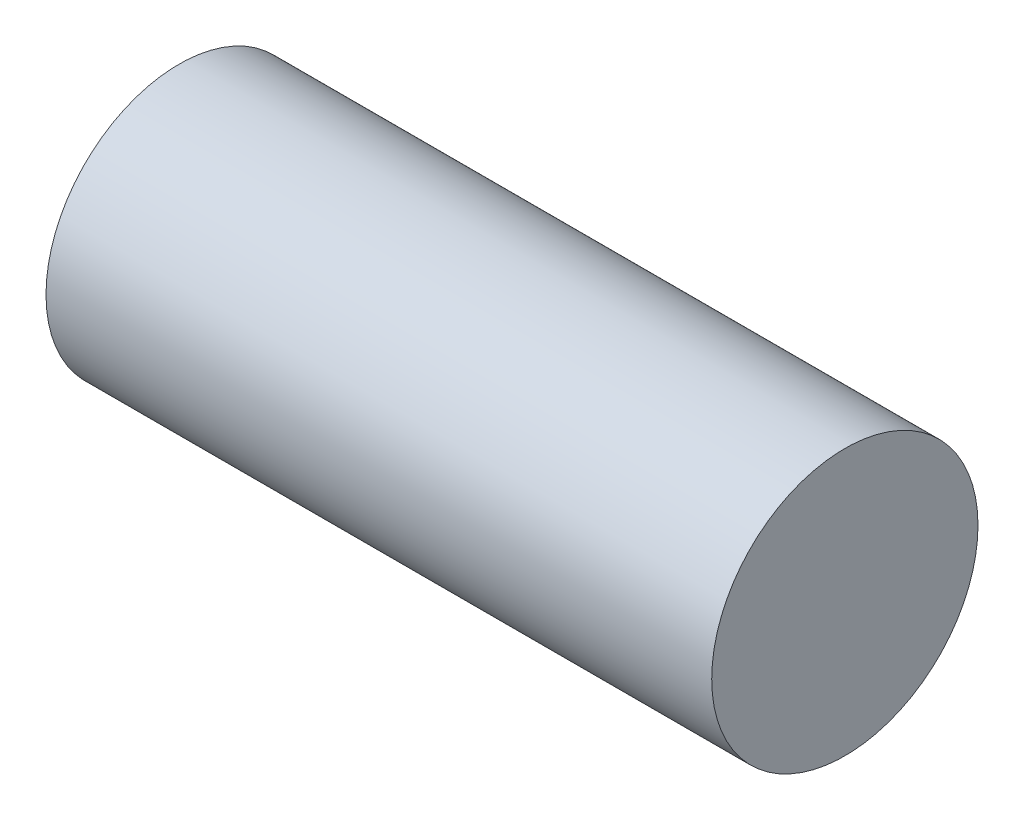
from build123d import *

# Parameters (mm, degrees)
SKETCH1_R           = 2.5
BOSS_EXTRUDE1_DEPTH = 12.5


with BuildPart() as part:
    # Sketch1 → Boss-Extrude1 (new body)
    with BuildSketch(Plane(origin=(0, 0, 0), x_dir=(0, 0, -1), z_dir=(1, 0, 0))):
        Circle(SKETCH1_R)
    extrude(amount=BOSS_EXTRUDE1_DEPTH)


solid = part.part
